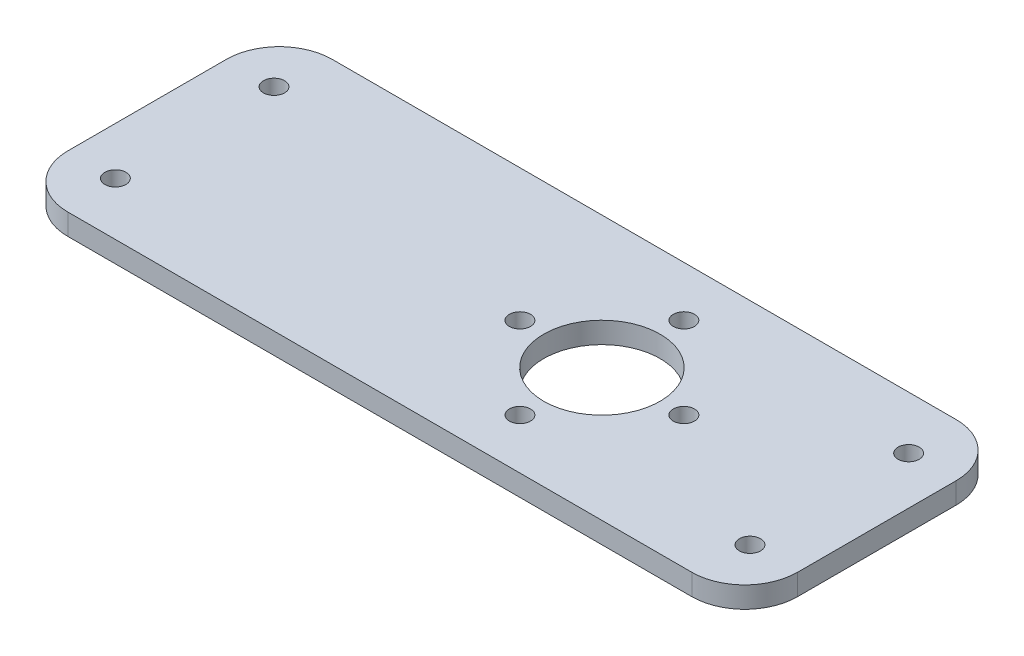
from build123d import *

# Parameters (mm, degrees)
SKETCH_1_W          = 143
SKETCH_1_H          = 50
SKETCH_1_R          = 2
SKETCH_1_R_2        = 11
EXTRUDE_1_DEPTH     = 4
SKETCH_4_W          = 5
SKETCH_4_H          = 50
CUT_EXTRUDE_3_DEPTH = 95.45633912
SKETCH_5_R          = 2
CUT_EXTRUDE_4_DEPTH = 90.649316785
FILLET_1_R          = 10


with BuildPart() as part:
    # 草图1 → 凸台-拉伸1 (new body)
    with BuildSketch(Plane(origin=(0, 0, 0), x_dir=(1, 0, 0), z_dir=(0, 1, 0))):
        with Locations((-19.5, 0)):
            Rectangle(SKETCH_1_W, SKETCH_1_H)
        with Locations(Location((-15.5, 0, 0), (0, 0, 270))):
            Circle(SKETCH_1_R, mode=Mode.SUBTRACT)
        with Locations(Location((0, 15.5, 0), (0, 0, 270))):
            Circle(SKETCH_1_R, mode=Mode.SUBTRACT)
        with Locations(Location((0, -15.5, 0), (0, 0, 270))):
            Circle(SKETCH_1_R, mode=Mode.SUBTRACT)
        with Locations(Location((43, -15, 0), (0, 0, 270))):
            Circle(SKETCH_1_R, mode=Mode.SUBTRACT)
        with Locations(Location((43, 15, 0), (0, 0, 270))):
            Circle(SKETCH_1_R, mode=Mode.SUBTRACT)
        with Locations(Location((0, 0, 0), (0, 0, 270))):
            Circle(SKETCH_1_R_2, mode=Mode.SUBTRACT)
        with Locations(Location((15.5, 0, 0), (0, 0, 270))):
            Circle(SKETCH_1_R, mode=Mode.SUBTRACT)
    extrude(amount=EXTRUDE_1_DEPTH)

    # 草图4 → 切除-拉伸3 (cut, through all)
    with BuildSketch(Plane(origin=(0, 4, 0), x_dir=(1, 0, 0), z_dir=(0, 1, 0))):
        with Locations((-88.5, 0)):
            Rectangle(SKETCH_4_W, SKETCH_4_H)
    extrude(amount=-CUT_EXTRUDE_3_DEPTH, mode=Mode.SUBTRACT)

    # 草图5 → 切除-拉伸4 (cut, through all)
    with BuildSketch(Plane(origin=(0, 4, 0), x_dir=(1, 0, 0), z_dir=(0, 1, 0))):
        with Locations(Location((-77, 15, 0), (0, 0, 270))):
            Circle(SKETCH_5_R)
        with Locations(Location((-77, -15, 0), (0, 0, 270))):
            Circle(SKETCH_5_R)
    extrude(amount=-CUT_EXTRUDE_4_DEPTH, mode=Mode.SUBTRACT)

    # 圆角1
    fillet_1_edges = [part.edges().sort_by_distance(p)[0] for p in [
        (52, 2, -25),
        (52, 2, 25),
        (-86, 2, -25),
        (-86, 2, 25),
    ]]
    fillet(fillet_1_edges, radius=FILLET_1_R)


solid = part.part
